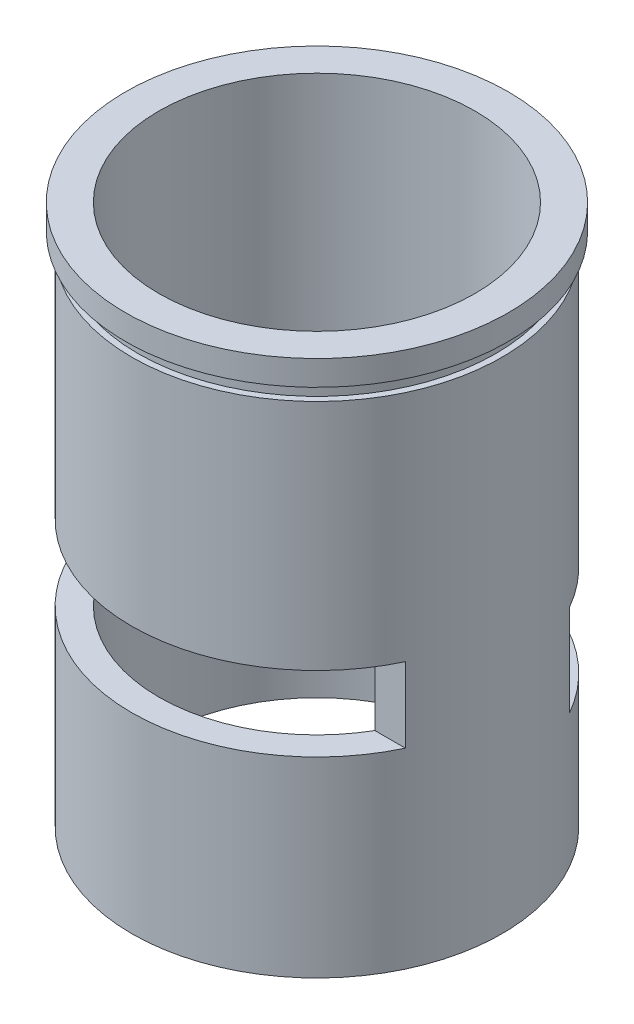
from build123d import *

# Parameters (mm, degrees)
ENL_V_MAT_EXTRU_2_DEPTH      = 54.054217551
ENL_V_MAT_EXTRU_2_DEPTH_BACK = 54.054217551
ESQUISSE3_W                  = 6.375
ESQUISSE3_H                  = 4.5
ESQUISSE3_W_2                = 5.625
ESQUISSE3_H_2                = 5.5


with BuildPart() as part:
    # Esquisse1 → Base-Révolution (revolve)
    with BuildSketch(Plane.XY):
        Polygon((10.75, 49), (10.75, 48), (11.125, 48), (11.125, 18), (9.5, 18), (9.5, 50.5), (11.5, 50.5), (11.5, 49), align=None)
    revolve(axis=Axis((0, 0, 0), (0, 1, 0)))

    # Esquisse3 → Enlèv. mat.-Extru.2 (cut, two sides: drawn at the far end of the back side and taken through both)
    with BuildSketch(Plane(origin=(0, 0, 0), x_dir=(0, 0, -1), z_dir=(1, 0, 0)).offset(-ENL_V_MAT_EXTRU_2_DEPTH_BACK)):
        with Locations((-7.9375, 31.75)):
            Rectangle(ESQUISSE3_W, ESQUISSE3_H)
        with Locations((8.3125, 28.75)):
            Rectangle(ESQUISSE3_W_2, ESQUISSE3_H_2)
    extrude(amount=ENL_V_MAT_EXTRU_2_DEPTH + ENL_V_MAT_EXTRU_2_DEPTH_BACK, mode=Mode.SUBTRACT)


solid = part.part
